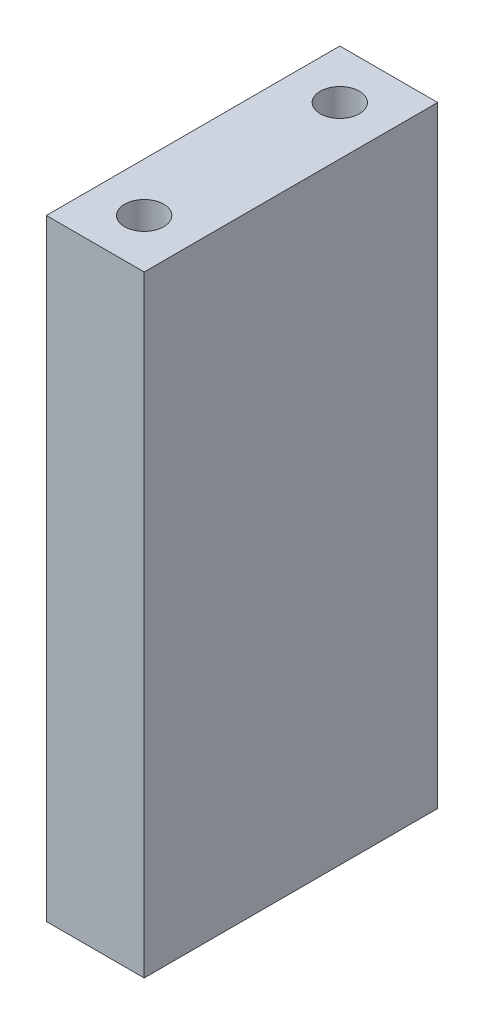
from build123d import *

# Parameters (mm, degrees)
CROQUIS1_W              = 60
CROQUIS1_H              = 125
SALIENTE_EXTRUIR1_DEPTH = 20
CROQUIS2_R              = 4
CORTAR_EXTRUIR1_DEPTH   = 25
CORTAR_EXTRUIR2_START   = -25
CROQUIS3_R              = 4
CORTAR_EXTRUIR2_DEPTH   = 25


with BuildPart() as part:
    # Croquis1 → Saliente-Extruir1 (new body)
    with BuildSketch(Plane(origin=(0, 0, 0), x_dir=(0, 0, -1), z_dir=(1, 0, 0))):
        Rectangle(CROQUIS1_W, CROQUIS1_H)
    extrude(amount=SALIENTE_EXTRUIR1_DEPTH)

    # Croquis2 → Cortar-Extruir1 (cut)
    with BuildSketch(Plane(origin=(0, 62.5, 0), x_dir=(1, 0, 0), z_dir=(0, 1, 0))):
        with Locations(Location((10, 20, 0), (0, 0, 270))):
            Circle(CROQUIS2_R)
        with Locations(Location((10, -20, 0), (0, 0, 270))):
            Circle(CROQUIS2_R)
    extrude(amount=-CORTAR_EXTRUIR1_DEPTH, mode=Mode.SUBTRACT)

    # Croquis3 → Cortar-Extruir2 (cut)
    with BuildSketch(Plane.XZ.offset(62.5).offset(CORTAR_EXTRUIR2_START)):
        with Locations(Location((10, 20, 0), (0, 0, 90))):
            Circle(CROQUIS3_R)
        with Locations(Location((10, -20, 0), (0, 0, 90))):
            Circle(CROQUIS3_R)
    extrude(amount=CORTAR_EXTRUIR2_DEPTH, mode=Mode.SUBTRACT)


solid = part.part
